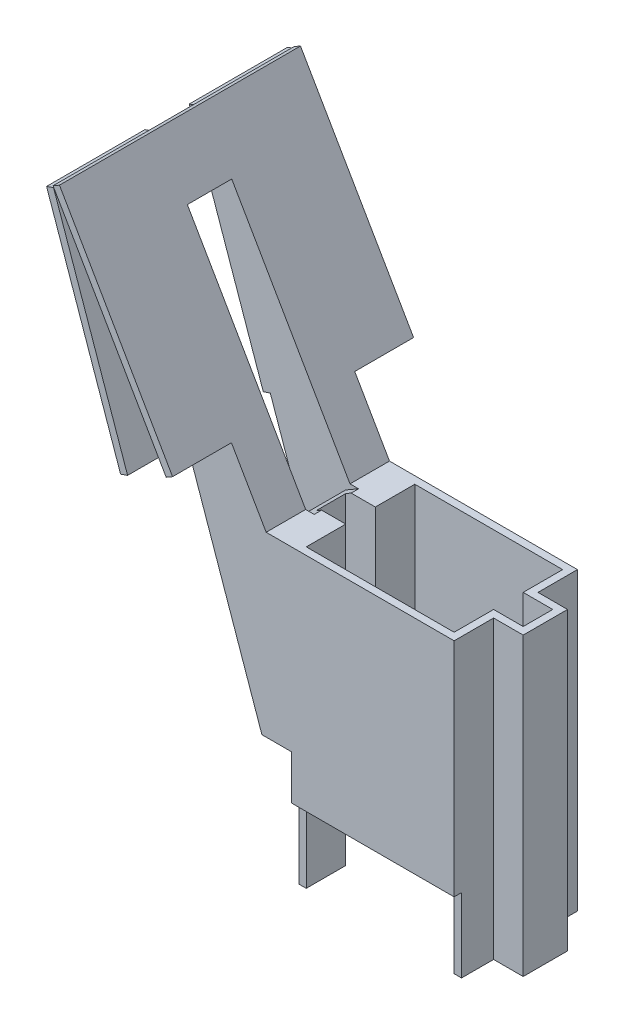
from build123d import *

# Parameters (mm, degrees)
AUFSATZ_LINEAR_AUSTRAGEN1_DEPTH  = 20
SCHNITT_LINEAR_AUSTRAGEN2_REACH  = 24.753
SKIZZE8_W                        = 11
SKIZZE8_H                        = 5
AUFSATZ_LINEAR_AUSTRAGEN3_DEPTH  = 8.34
SCHNITT_LINEAR_AUSTRAGEN3_REACH  = 28.626
SKIZZE12_W                       = 1.5
SKIZZE12_H                       = 2
AUFSATZ_LINEAR_AUSTRAGEN4_DEPTH  = 3.98
AUFSATZ_LINEAR_AUSTRAGEN5_DEPTH  = 2.67
AUFSATZ_LINEAR_AUSTRAGEN6_DEPTH  = 2.67
SCHNITT_LINEAR_AUSTRAGEN4_REACH  = 43.942
SKIZZE17_W                       = 3
SKIZZE17_H                       = 16.288675134
AUFSATZ_LINEAR_AUSTRAGEN15_DEPTH = 6.65


with BuildPart() as part:
    # Skizze1 → Aufsatz-Linear austragen1 (new body)
    with BuildSketch(Plane(origin=(0, 0, 0), x_dir=(1, 0, 0), z_dir=(0, 1, 0))):
        Polygon((5.5, -4.17), (-5.5, -4.17), (-5.5, -1.5), (-7.5, -1.5), (-7.5, 1.5), (-5.5, 1.5), (-5.5, 4.17), (5.5, 4.17), (5.5, 1.5), (7.5, 1.5), (7.5, -1.5), (5.5, -1.5), align=None)
        Polygon((-5, 1), (-5, 3.67), (5, 3.67), (5, 1), (7, 1), (7, -1), (5, -1), (5, -3.67), (-5, -3.67), (-5, -1), (-7, -1), (-7, 1), align=None, mode=Mode.SUBTRACT)
    extrude(amount=AUFSATZ_LINEAR_AUSTRAGEN1_DEPTH)

    # Skizze8 → Schnitt-Linear austragen2 (cut, up to next)
    with BuildSketch(Plane(origin=(0, 0, 3.67), x_dir=(-1, 0, 0), z_dir=(0, 0, -1)), mode=Mode.PRIVATE) as schnitt_linear_austragen2_sk1:
        with Locations((0, 2.5)):
            Rectangle(SKIZZE8_W, SKIZZE8_H)
    schnitt_linear_austragen2_tool1 = extrude(schnitt_linear_austragen2_sk1.sketch, amount=-SCHNITT_LINEAR_AUSTRAGEN2_REACH, mode=Mode.PRIVATE) & part.part
    add(schnitt_linear_austragen2_tool1.solids().sort_by_distance((0, 2.5, 3.67))[0], mode=Mode.SUBTRACT)

    # Skizze10 → Aufsatz-Linear austragen3 (add)
    with BuildSketch(Plane(origin=(0, 0, -4.17), x_dir=(-1, 0, 0), z_dir=(0, 0, -1))):
        Polygon((5.5, 20), (7.211324865, 20), (17.211324865, 37.320508076), (17.644337567, 37.070508076), (7.5, 19.5), (5.5, 19.5), align=None)
    extrude(amount=-AUFSATZ_LINEAR_AUSTRAGEN3_DEPTH)

    # Skizze12 → Schnitt-Linear austragen3 (cut, up to next)
    with BuildSketch(Plane.XZ.offset(-19.5), mode=Mode.PRIVATE) as schnitt_linear_austragen3_sk1:
        with Locations((-6.25, 0)):
            Rectangle(SKIZZE12_W, SKIZZE12_H)
    schnitt_linear_austragen3_tool1 = extrude(schnitt_linear_austragen3_sk1.sketch, amount=-SCHNITT_LINEAR_AUSTRAGEN3_REACH, mode=Mode.PRIVATE) & part.part
    add(schnitt_linear_austragen3_tool1.solids().sort_by_distance((-6.25, 19.5, 0))[0], mode=Mode.SUBTRACT)

    # Skizze13 → Aufsatz-Linear austragen4 (add)
    with BuildSketch(Plane(origin=(0, 0, -4.17), x_dir=(-1, 0, 0), z_dir=(0, 0, -1))):
        Polygon((17.211324865, 37.320508076), (9.561324865, 24.070319398), (9.994337567, 23.820319398), (17.644337567, 37.070508076), align=None)
    aufsatz_linear_austragen4 = extrude(amount=AUFSATZ_LINEAR_AUSTRAGEN4_DEPTH)

    # Skizze15 → Aufsatz-Linear austragen5 (add)
    with BuildSketch(Plane(origin=(0, 0, -1.5), x_dir=(-1, 0, 0), z_dir=(0, 0, -1))):
        Polygon((5.5, 8), (5.5, 19.5), (7.5, 19.5), (17.644337567, 37.070508076), (7.5, 8), align=None)
    extrude(amount=AUFSATZ_LINEAR_AUSTRAGEN5_DEPTH)

    # Spiegeln1: Aufsatz-Linear austragen4 across plane
    add(aufsatz_linear_austragen4.mirror(Plane.XY))

    # Skizze16 → Aufsatz-Linear austragen6 (add)
    with BuildSketch(Plane.XY.offset(1.5)):
        Polygon((-17.644337567, 37.070508076), (-7.5, 8), (-5.5, 8), (-5.5, 19.5), (-7.5, 19.5), align=None)
    extrude(amount=AUFSATZ_LINEAR_AUSTRAGEN6_DEPTH)

    # Skizze17 → Schnitt-Linear austragen4 (cut, up to next)
    with BuildSketch(Plane(origin=(2.818747687, 1.627404736, 0), x_dir=(0, 0, 1), z_dir=(-0.8660254037844417, -0.49999999999999467, 0)), mode=Mode.PRIVATE) as schnitt_linear_austragen4_sk1:
        with Locations((0, 28.781832941)):
            Rectangle(SKIZZE17_W, SKIZZE17_H)
    schnitt_linear_austragen4_tool1 = extrude(schnitt_linear_austragen4_sk1.sketch, amount=-SCHNITT_LINEAR_AUSTRAGEN4_REACH, mode=Mode.PRIVATE) & part.part
    add(schnitt_linear_austragen4_tool1.solids().sort_by_distance((-11.572169, 26.553203, 0))[0], mode=Mode.SUBTRACT)

    # Skizze22 → Aufsatz-Linear austragen15 (add)
    with BuildSketch(Plane.XY.offset(-1.5)):
        Polygon((-17.611390326, 36.976091556), (-12.603409607, 22.624780496), (-13.075492208, 22.460044288), (-18.083472926, 36.811355348), align=None)
    aufsatz_linear_austragen15 = extrude(amount=-AUFSATZ_LINEAR_AUSTRAGEN15_DEPTH)

    # Spiegeln2: Aufsatz-Linear austragen15 across plane
    add(aufsatz_linear_austragen15.mirror(Plane.XY))


solid = part.part
